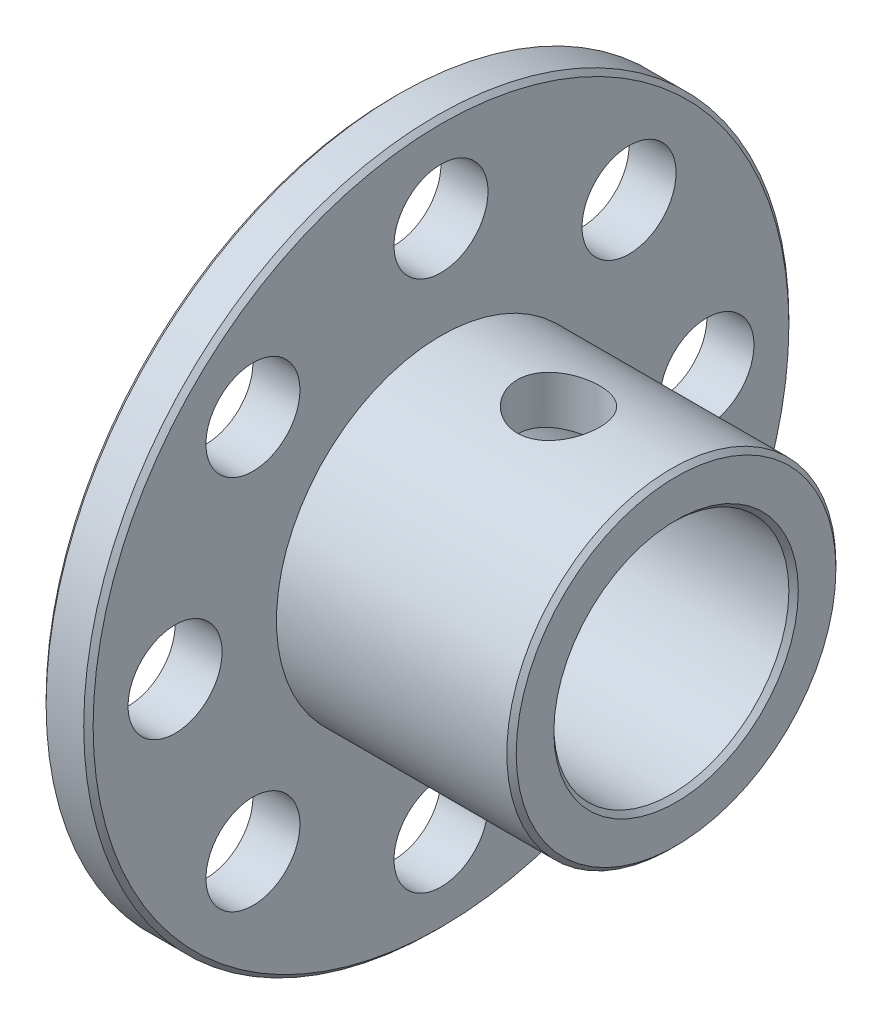
from build123d import *

# Parameters (mm, degrees)
SKETCH_1_R          = 15
EXTRUDE_1_DEPTH     = 2
SKETCH_2_R          = 7
EXTRUDE_2_DEPTH     = 10
SKETCH_3_R          = 2
CUT_EXTRUDE_1_DEPTH = 24.452078799
SKETCH_4_R          = 5
CUT_EXTRUDE_2_DEPTH = 25.372115214
CHAMFER_1_SIZE      = 0.2
SKETCH_5_R          = 1.75
CUT_EXTRUDE_3_DEPTH = 10


with BuildPart() as part:
    # 草图1 → 凸台-拉伸1 (new body)
    with BuildSketch(Plane(origin=(0, 0, 0), x_dir=(0, 0, -1), z_dir=(1, 0, 0))):
        Circle(SKETCH_1_R)
    extrude(amount=EXTRUDE_1_DEPTH)

    # 草图2 → 凸台-拉伸2 (add)
    with BuildSketch(Plane(origin=(2, 0, 0), x_dir=(0, 0, -1), z_dir=(1, 0, 0))):
        Circle(SKETCH_2_R)
    extrude(amount=EXTRUDE_2_DEPTH)

    # 草图3 → 切除-拉伸1 (cut, through all)
    with BuildSketch(Plane(origin=(2, 0, 0), x_dir=(0, 0, -1), z_dir=(1, 0, 0))):
        with Locations((0, 11.313708499)):
            Circle(SKETCH_3_R)
        with Locations((8, 8)):
            Circle(SKETCH_3_R)
        with Locations((11.313708499, 0)):
            Circle(SKETCH_3_R)
        with Locations((8, -8)):
            Circle(SKETCH_3_R)
        with Locations((0, -11.313708499)):
            Circle(SKETCH_3_R)
        with Locations((-8, -8)):
            Circle(SKETCH_3_R)
        with Locations((-11.313708499, 0)):
            Circle(SKETCH_3_R)
        with Locations((-8, 8)):
            Circle(SKETCH_3_R)
    extrude(amount=-CUT_EXTRUDE_1_DEPTH, mode=Mode.SUBTRACT)

    # 草图4 → 切除-拉伸2 (cut, through all)
    with BuildSketch(Plane(origin=(12, 0, 0), x_dir=(0, 0, -1), z_dir=(1, 0, 0))):
        Circle(SKETCH_4_R)
    extrude(amount=-CUT_EXTRUDE_2_DEPTH, mode=Mode.SUBTRACT)

    # 倒角1
    chamfer_1_edges = [part.edges().sort_by_distance(p)[0] for p in [
        (0, 0, 15),
        (0, 0, 5),
        (12, 0, 5),
        (2, 0, 15),
        (12, 0, 7),
    ]]
    chamfer(chamfer_1_edges, length=CHAMFER_1_SIZE)

    # 草图5 → 切除-拉伸3 (cut)
    with BuildSketch(Plane(origin=(0, 0, 0), x_dir=(1, 0, 0), z_dir=(0, 1, 0))):
        with Locations(Location((7, 0, 0), (0, 0, 90))):
            Circle(SKETCH_5_R)
    extrude(amount=CUT_EXTRUDE_3_DEPTH, mode=Mode.SUBTRACT)


solid = part.part
